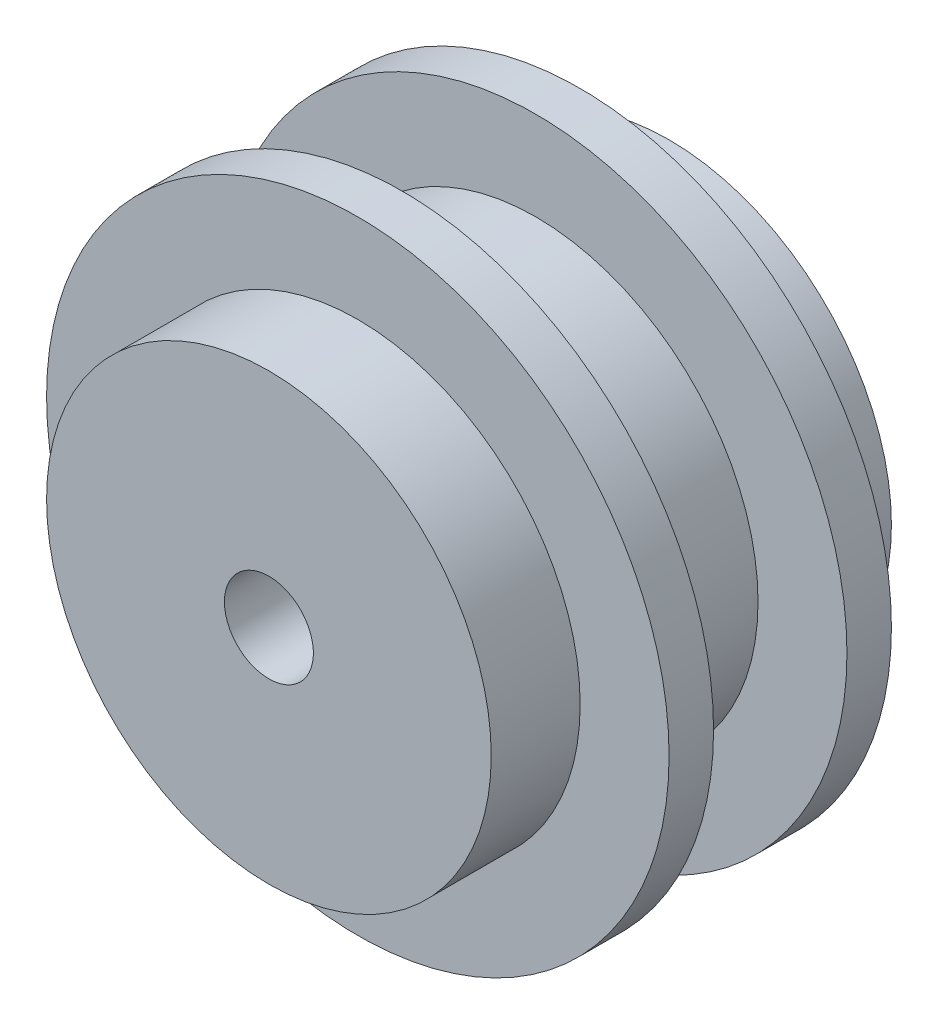
from build123d import *

# Parameters (mm, degrees)
SKETCH2_R          = 50
CUT_EXTRUDE1_DEPTH = 828.647267862


with BuildPart() as part:
    # Sketch1 → Revolve1 (revolve)
    with BuildSketch(Plane(origin=(0, 0, 0), x_dir=(0, 0, -1), z_dir=(1, 0, 0)), mode=Mode.PRIVATE) as revolve1_sk:
        Polygon((0, 0), (0, 250), (450, 250), (450, 0), (350, 0), (350, -100), (300, -100), (300, 0), (150, 0), (150, -100), (100, -100), (100, 0), align=None)
    revolve(revolve1_sk.sketch.rotate(Axis((0, 250, 0), (0, 0, -1)), 270), axis=Axis((0, 250, 0), (0, 0, -1)))

    # Sketch2 → Cut-Extrude1 (cut, through all)
    with BuildSketch(Plane(origin=(0, 0, -450), x_dir=(-1, 0, 0), z_dir=(0, 0, -1))):
        with Locations((0, 250)):
            Circle(SKETCH2_R)
    extrude(amount=-CUT_EXTRUDE1_DEPTH, mode=Mode.SUBTRACT)


solid = part.part
